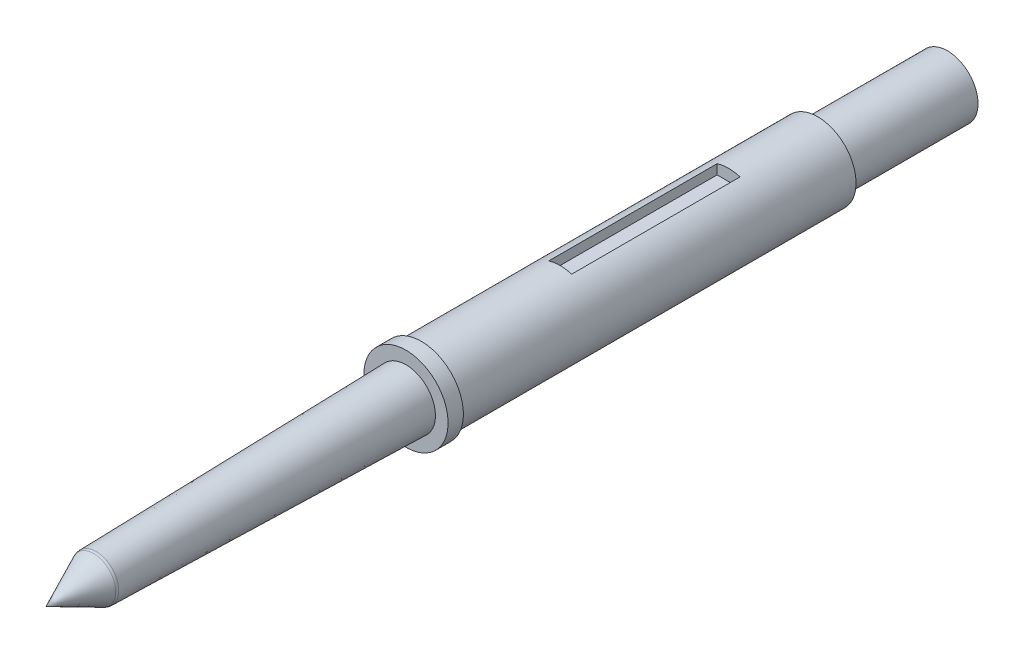
from build123d import *

# Parameters (mm, degrees)
SKETCH4_W          = 4.7625
SKETCH4_H          = 34.925
CUT_EXTRUDE1_DEPTH = 2.38125


with BuildPart() as part:
    # Sketch3 → Revolve2 (revolve)
    with BuildSketch(Plane(origin=(0, 0, 0), x_dir=(0, 0, -1), z_dir=(1, 0, 0)), mode=Mode.PRIVATE) as revolve2_sk:
        with BuildLine():
            Line((-186.95544175, 0), (-177.8, 0))
            Line((-177.8, 0), (0, 0))
            Line((0, 0), (0, 6.35))
            Line((0, 6.35), (-26.8925, 6.35))
            Line((-26.8925, 6.35), (-26.8925, 7.9375))
            Line((-26.8925, 7.9375), (-109.125, 7.9375))
            Line((-109.125, 7.9375), (-109.125, 8.73125))
            Line((-109.125, 8.73125), (-112.3, 8.73125))
            Line((-112.3, 8.73125), (-112.3, 6.109884817))
            Line((-112.3, 6.109884817), (-176.558072773, 4.689142192))
            ThreePointArc((-176.558072773, 4.689142192), (-176.816471065, 4.656721397), (-177.062823544, 4.572274718))
            Line((-177.062823544, 4.572274718), (-186.95544175, 0))
        make_face()
    revolve(revolve2_sk.sketch.rotate(Axis((0, 0, 0), (0, 0, 1)), 90), axis=Axis((0, 0, 0), (0, 0, 1)))

    # Sketch4 → Cut-Extrude1 (cut)
    with BuildSketch(Plane(origin=(0, 7.9375, 0), x_dir=(1, 0, 0), z_dir=(0, 1, 0))):
        with Locations((0, -62.855066403)):
            Rectangle(SKETCH4_W, SKETCH4_H)
    extrude(amount=-CUT_EXTRUDE1_DEPTH, mode=Mode.SUBTRACT)


solid = part.part
